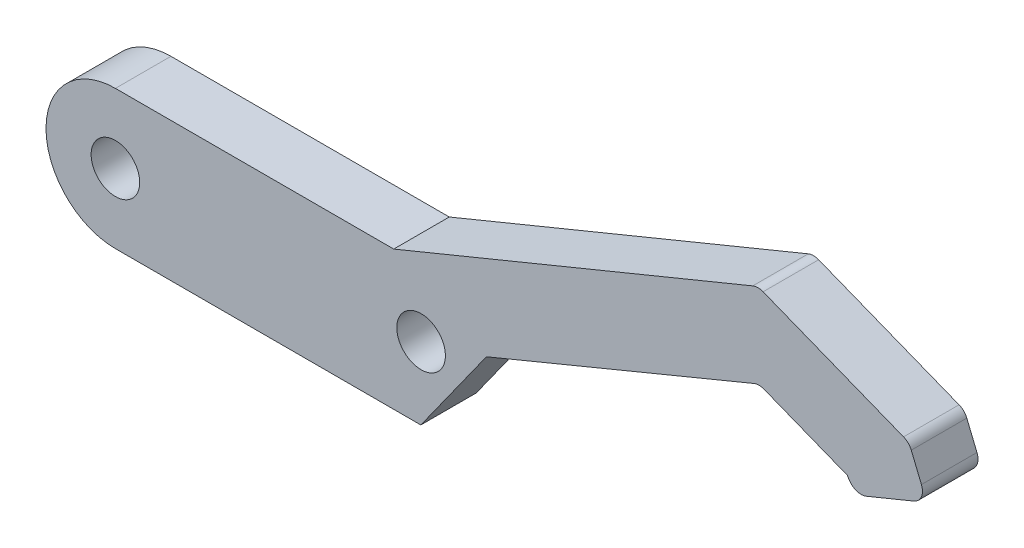
from build123d import *

# Parameters (mm, degrees)
SKETCH1_R               = 1.5
BOSS_EXTRUDE3_DEPTH     = 4
CONG_3_R                = 1
CONG_4_R                = 1
ESQUISSE1_R             = 1.75
ENL_V_MAT_EXTRU_1_DEPTH = 10


with BuildPart() as part:
    # Sketch1 → Boss-Extrude3 (new body)
    with BuildSketch(Plane.XY):
        with BuildLine():
            Line((20.05, 5), (0, 5))
            ThreePointArc((0, 5), (-5, 0), (0, -5))
            Line((0, -5), (22, -5))
            Line((22, -5), (26.729403417, 1.622573056))
            Line((26.729403417, 1.622573056), (46.35880254, 9.735790053))
            Line((46.35880254, 9.735790053), (52.718761051, 7.224926885))
            Line((52.718761051, 7.224926885), (53.329707658, 6.286771643))
            Line((53.329707658, 6.286771643), (58.443335859, 8.389238381))
            Line((58.443335859, 8.389238381), (57.169030474, 11.488609151))
            Line((57.169030474, 11.488609151), (46.283795068, 15.786017162))
            Line((46.283795068, 15.786017162), (20.05, 5))
        make_face()
        Circle(SKETCH1_R, mode=Mode.SUBTRACT)
        with Locations((22.020705275, 0.206842568)):
            Circle(SKETCH1_R, mode=Mode.SUBTRACT)
    extrude(amount=BOSS_EXTRUDE3_DEPTH)

    # Congé3
    cong_3_edges = [part.edges().sort_by_distance(p)[0] for p in [
        (58.443335859, 8.389238381, 2),
        (53.329707658, 6.286771643, 2),
        (46.35880254, 9.735790053, 2),
    ]]
    fillet(cong_3_edges, radius=CONG_3_R)

    # Congé4
    cong_4_edges = [part.edges().sort_by_distance(p)[0] for p in [
        (46.283795068, 15.786017162, 2),
        (57.169030474, 11.488609151, 2),
    ]]
    fillet(cong_4_edges, radius=CONG_4_R)

    # Esquisse1 → Enlèv. mat.-Extru.1 (cut)
    with BuildSketch(Plane.XY.offset(4)):
        with Locations((22.020705275, 0.206842568)):
            Circle(ESQUISSE1_R)
        Circle(ESQUISSE1_R)
    extrude(amount=-ENL_V_MAT_EXTRU_1_DEPTH, mode=Mode.SUBTRACT)


solid = part.part
